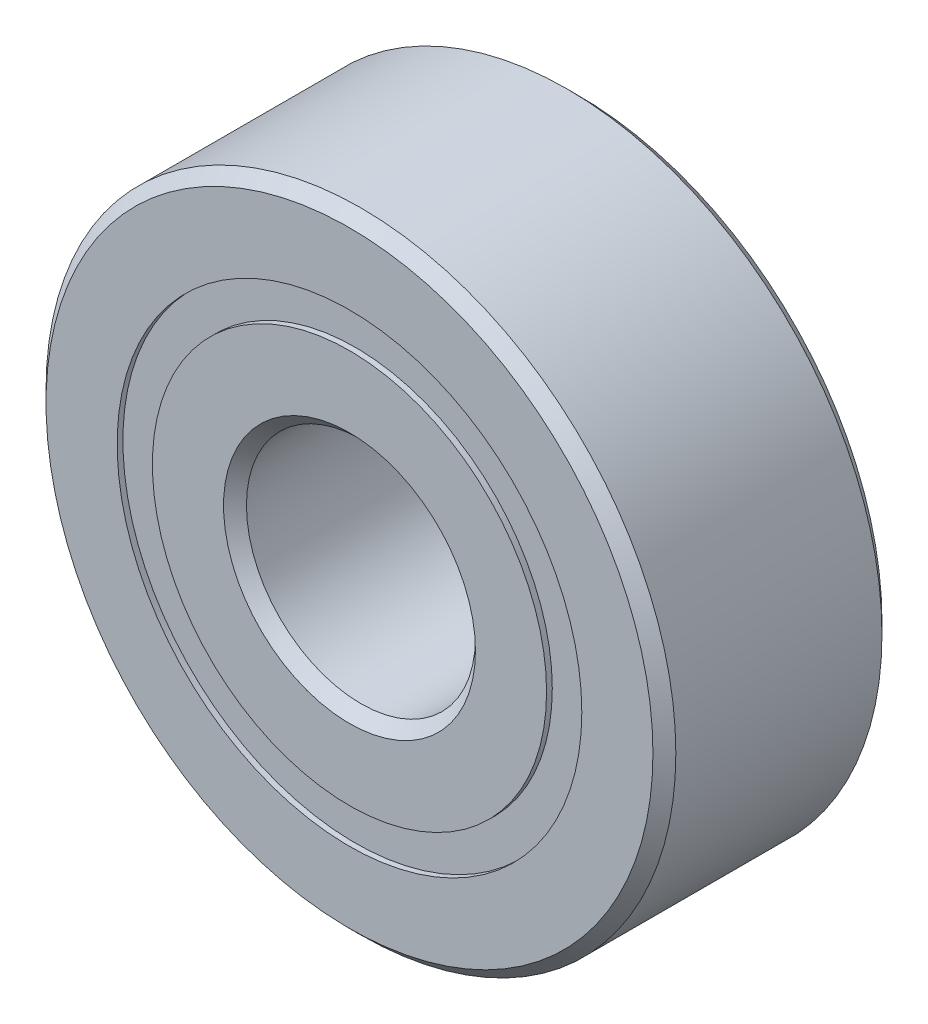
from build123d import *

# Parameters (mm, degrees)
CIRPATTERN1_COUNT = 12
SKETCH5_W         = 0.959362975
SKETCH5_H         = 0.615384616


with BuildPart() as part:
    # Sketch1 → Revolve1 (revolve)
    with BuildSketch(Plane(origin=(0, 0, 0), x_dir=(0, 0, -1), z_dir=(1, 0, 0)), mode=Mode.PRIVATE) as revolve1_sk:
        with BuildLine():
            Line((1.8, 5.5), (-1.8, 5.5))
            Line((-1.8, 5.5), (-2, 5.3))
            Line((-2, 5.3), (-2, 4.057692308))
            Line((-2, 4.057692308), (-0.888888889, 4.057692308))
            ThreePointArc((-0.888888889, 4.057692308), (0, 4.690637025), (0.888888889, 4.057692308))
            Line((0.888888889, 4.057692308), (2, 4.057692308))
            Line((2, 4.057692308), (2, 5.3))
            Line((2, 5.3), (1.8, 5.5))
        make_face()
    revolve(revolve1_sk.sketch.rotate(Axis((0, 0, 2), (0, 0, -1)), 90), axis=Axis((0, 0, 2), (0, 0, -1)))


with BuildPart() as body_2:
    # Sketch3 → Revolve3 (revolve)
    with BuildSketch(Plane(origin=(0, 0, 0), x_dir=(0, 0, -1), z_dir=(1, 0, 0)), mode=Mode.PRIVATE) as revolve3_sk:
        with BuildLine():
            Line((-2, 3.442307692), (-0.888888889, 3.442307692))
            ThreePointArc((-0.888888889, 3.442307692), (0, 2.809362975), (0.888888889, 3.442307692))
            Line((0.888888889, 3.442307692), (2, 3.442307692))
            Line((2, 3.442307692), (2, 2.2))
            Line((2, 2.2), (1.8, 2))
            Line((1.8, 2), (-1.8, 2))
            Line((-1.8, 2), (-2, 2.2))
            Line((-2, 2.2), (-2, 3.442307692))
        make_face()
    revolve(revolve3_sk.sketch.rotate(Axis((0, 0, 2), (0, 0, -1)), 90), axis=Axis((0, 0, 2), (0, 0, -1)))


with BuildPart() as body_3:
    # Sketch4 → Revolve4 (revolve)
    with BuildSketch(Plane(origin=(0, 0, 0), x_dir=(0, 0, -1), z_dir=(1, 0, 0))):
        with BuildLine():
            Line((-0.940637025, 3.75), (0.940637025, 3.75))
            ThreePointArc((0.940637025, 3.75), (0, 4.690637025), (-0.940637025, 3.75))
        make_face()
    revolve(axis=Axis((0, 3.75, 0.940637025), (0, 0, -1)))


with BuildPart() as cirpattern1_1:
    # CirPattern1: pattern copy
    add(body_3.part.rotate(Axis((0, 0, 0), (0, 0, 1)), 1 * 360 / CIRPATTERN1_COUNT))


with BuildPart() as cirpattern1_2:
    # CirPattern1: pattern copy
    add(body_3.part.rotate(Axis((0, 0, 0), (0, 0, 1)), 2 * 360 / CIRPATTERN1_COUNT))


with BuildPart() as cirpattern1_3:
    # CirPattern1: pattern copy
    add(body_3.part.rotate(Axis((0, 0, 0), (0, 0, 1)), 3 * 360 / CIRPATTERN1_COUNT))


with BuildPart() as cirpattern1_4:
    # CirPattern1: pattern copy
    add(body_3.part.rotate(Axis((0, 0, 0), (0, 0, 1)), 4 * 360 / CIRPATTERN1_COUNT))


with BuildPart() as cirpattern1_5:
    # CirPattern1: pattern copy
    add(body_3.part.rotate(Axis((0, 0, 0), (0, 0, 1)), 5 * 360 / CIRPATTERN1_COUNT))


with BuildPart() as cirpattern1_6:
    # CirPattern1: pattern copy
    add(body_3.part.rotate(Axis((0, 0, 0), (0, 0, 1)), 6 * 360 / CIRPATTERN1_COUNT))


with BuildPart() as cirpattern1_7:
    # CirPattern1: pattern copy
    add(body_3.part.rotate(Axis((0, 0, 0), (0, 0, 1)), 7 * 360 / CIRPATTERN1_COUNT))


with BuildPart() as cirpattern1_8:
    # CirPattern1: pattern copy
    add(body_3.part.rotate(Axis((0, 0, 0), (0, 0, 1)), 8 * 360 / CIRPATTERN1_COUNT))


with BuildPart() as cirpattern1_9:
    # CirPattern1: pattern copy
    add(body_3.part.rotate(Axis((0, 0, 0), (0, 0, 1)), 9 * 360 / CIRPATTERN1_COUNT))


with BuildPart() as cirpattern1_10:
    # CirPattern1: pattern copy
    add(body_3.part.rotate(Axis((0, 0, 0), (0, 0, 1)), 10 * 360 / CIRPATTERN1_COUNT))


with BuildPart() as cirpattern1_11:
    # CirPattern1: pattern copy
    add(body_3.part.rotate(Axis((0, 0, 0), (0, 0, 1)), 11 * 360 / CIRPATTERN1_COUNT))


with BuildPart() as body_15:
    # Sketch5 → Revolve5 (revolve)
    with BuildSketch(Plane(origin=(0, 0, 0), x_dir=(0, 0, -1), z_dir=(1, 0, 0)), mode=Mode.PRIVATE) as revolve5_sk:
        with Locations((-1.420318513, 3.75)):
            Rectangle(SKETCH5_W, SKETCH5_H)
        with Locations((1.420318513, 3.75)):
            Rectangle(SKETCH5_W, SKETCH5_H)
    revolve(revolve5_sk.sketch.rotate(Axis((0, 0, 2), (0, 0, -1)), 90), axis=Axis((0, 0, 2), (0, 0, -1)))


solid = Compound([part.part, body_2.part, body_3.part, cirpattern1_1.part, cirpattern1_2.part, cirpattern1_3.part, cirpattern1_4.part, cirpattern1_5.part, cirpattern1_6.part, cirpattern1_7.part, cirpattern1_8.part, cirpattern1_9.part, cirpattern1_10.part, cirpattern1_11.part, body_15.part])
